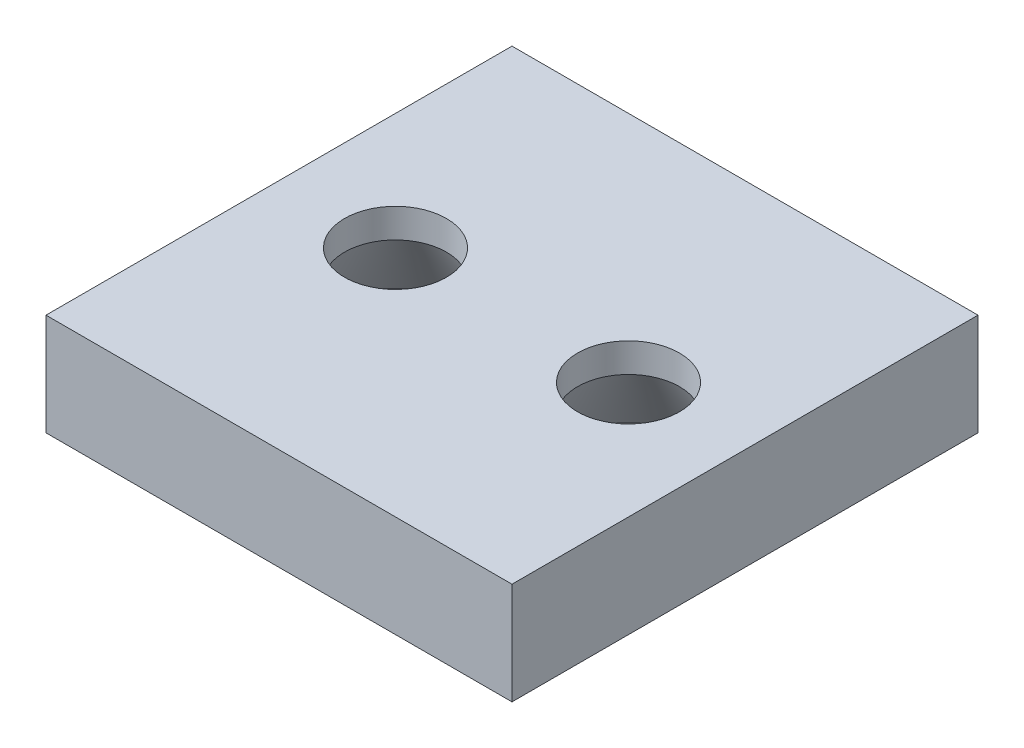
from build123d import *

# Parameters (mm, degrees)
SKETCH1_W           = 32
SKETCH1_H           = 32
BOSS_EXTRUDE1_DEPTH = 7
LPATTERN2_COUNT     = 2
LPATTERN2_PITCH     = 16


with BuildPart() as part:
    # Sketch1 → Boss-Extrude1 (new body)
    with BuildSketch(Plane(origin=(0, 0, 0), x_dir=(1, 0, 0), z_dir=(0, 1, 0))):
        Rectangle(SKETCH1_W, SKETCH1_H)
    extrude(amount=BOSS_EXTRUDE1_DEPTH)

    # Sketch3 → CSK for M1.6 Countersunk Flat Head Screw1 (revolve, cut)
    with BuildSketch(Plane(origin=(8, 0, 0), x_dir=(0, 0, -1), z_dir=(1, 0, 0))):
        Polygon((0, 0), (0, 7), (3.5, 7), (3.5, 4.999754046), (6.5, 0), align=None)
    csk_for_m1_6_countersunk_flat_head_screw = revolve(axis=Axis((8, -6.35, 0), (0, 1, 0)), mode=Mode.SUBTRACT)

    # LPattern2: CSK for M1.6 Countersunk Flat Head Screw1 ×2
    with Locations(*[(-i * LPATTERN2_PITCH, 0, 0) for i in range(1, LPATTERN2_COUNT)]):
        add(csk_for_m1_6_countersunk_flat_head_screw, mode=Mode.SUBTRACT)


solid = part.part
